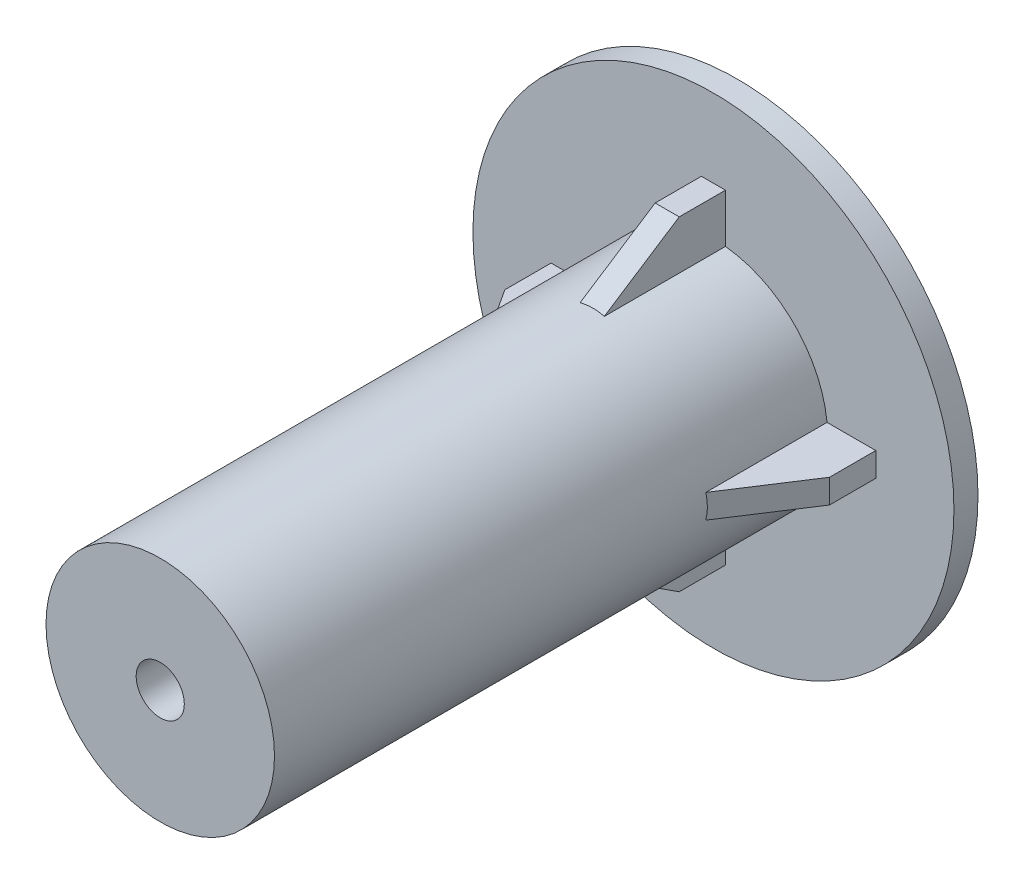
from build123d import *

# Parameters (mm, degrees)
SKETCH1_R           = 47.5
BOSS_EXTRUDE1_DEPTH = 230
SKETCH2_R           = 10
CUT_EXTRUDE1_DEPTH  = 20
SKETCH3_R           = 100
BOSS_EXTRUDE2_DEPTH = 10
RIB1_REACH          = 272
SKETCH4_WALL_W      = 601.63430221
SKETCH4_WALL_H      = 10
CIRPATTERN1_COUNT   = 4
SKETCH5_OUTSIDE_W   = 276.188
SKETCH5_OUTSIDE_H   = 276.188
SKETCH5_OUTSIDE_W_2 = 135
SKETCH5_OUTSIDE_H_2 = 135
CUT_EXTRUDE2_DEPTH  = 74


with BuildPart() as part:
    # Sketch1 → Boss-Extrude1 (new body)
    with BuildSketch(Plane.XY):
        Circle(SKETCH1_R)
    extrude(amount=BOSS_EXTRUDE1_DEPTH)

    # Sketch2 → Cut-Extrude1 (cut)
    with BuildSketch(Plane.XY.offset(230)):
        Circle(SKETCH2_R)
    extrude(amount=-CUT_EXTRUDE1_DEPTH, mode=Mode.SUBTRACT)

    # Sketch3 → Boss-Extrude2 (add)
    with BuildSketch(Plane(origin=(0, 0, 0), x_dir=(-1, 0, 0), z_dir=(0, 0, -1))):
        Circle(SKETCH3_R)
    extrude(amount=BOSS_EXTRUDE2_DEPTH)

    # Sketch4 wall → Rib1 (add, up to next)
    with BuildSketch(Plane(origin=(-63.75, 0, 25), x_dir=(-0.544988350595, 0, -0.838443616301), z_dir=(-0.838443616301, 0, 0.544988350595)), mode=Mode.PRIVATE) as rib1_sk1:
        Rectangle(SKETCH4_WALL_W, SKETCH4_WALL_H)
    rib1_tool1 = extrude(rib1_sk1.sketch, amount=-RIB1_REACH, mode=Mode.PRIVATE) - part.part
    rib1 = rib1_tool1.solids().sort_by_distance((-63.75, 0, 25))[0]
    add(rib1)

    # CirPattern1: Rib1 ×4 about axis
    cirpattern1_axis = Axis((0, 0, 0), (0, 0, 1))
    for i in range(1, CIRPATTERN1_COUNT):
        add(rib1.rotate(cirpattern1_axis, i * 360 / CIRPATTERN1_COUNT))

    # Sketch5 outside → Cut-Extrude2 (cut)
    with BuildSketch(Plane.XY):
        Rectangle(SKETCH5_OUTSIDE_W, SKETCH5_OUTSIDE_H)
        Rectangle(SKETCH5_OUTSIDE_W_2, SKETCH5_OUTSIDE_H_2, mode=Mode.SUBTRACT)
    extrude(amount=CUT_EXTRUDE2_DEPTH, mode=Mode.SUBTRACT)


solid = part.part
